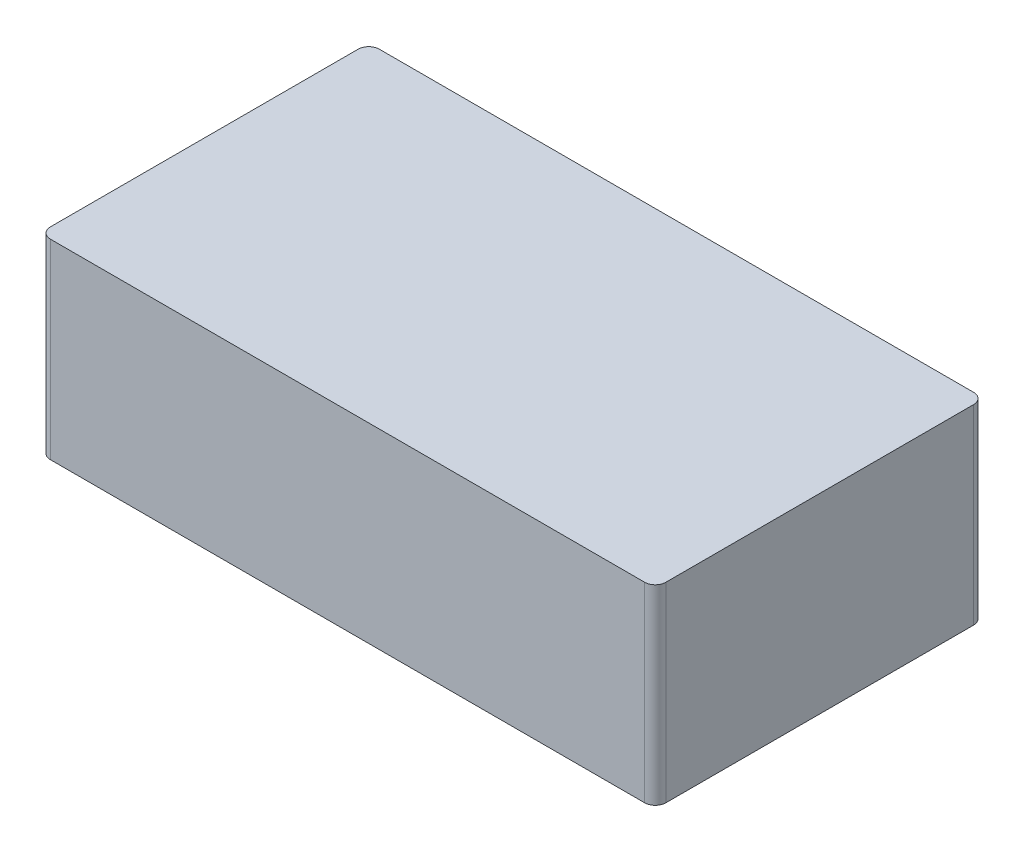
from build123d import *

# Parameters (mm, degrees)
SKETCH1_W           = 58
SKETCH1_H           = 31
BOSS_EXTRUDE1_DEPTH = 18
FILLET2_R           = 1


with BuildPart() as part:
    # Sketch1 → Boss-Extrude1 (new body)
    with BuildSketch(Plane(origin=(0, 0, 0), x_dir=(1, 0, 0), z_dir=(0, 1, 0))):
        with Locations((29, 15.5)):
            Rectangle(SKETCH1_W, SKETCH1_H)
    extrude(amount=BOSS_EXTRUDE1_DEPTH)

    # Fillet2
    fillet2_edges = [part.edges().sort_by_distance(p)[0] for p in [
        (0, 9, -31),
        (58, 9, -31),
        (58, 9, 0),
        (0, 9, 0),
    ]]
    fillet(fillet2_edges, radius=FILLET2_R)


solid = part.part
